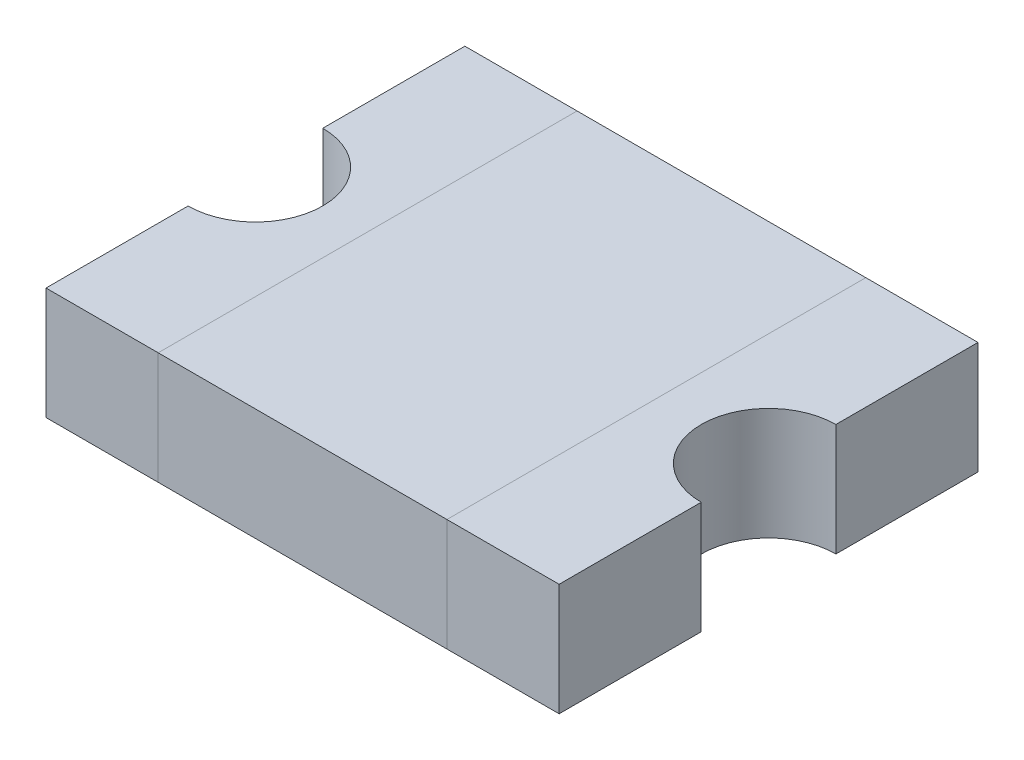
from build123d import *

# Parameters (mm, degrees)
SKETCH1_W             = 1.93
SKETCH1_H             = 2.8
BOSS_EXTRUDE1_DEPTH   = 0.75
BOSS_EXTRUDE3_DEPTH   = 0.75
BOSS_EXTRUDE3_2_DEPTH = 0.75


with BuildPart() as part:
    # Sketch1 → Boss-Extrude1 (new body)
    with BuildSketch(Plane(origin=(0, 0, 0), x_dir=(1, 0, 0), z_dir=(0, 1, 0))):
        Rectangle(SKETCH1_W, SKETCH1_H)
    extrude(amount=BOSS_EXTRUDE1_DEPTH)


with BuildPart() as body_2:
    # Sketch2 → Boss-Extrude3 (new body)
    with BuildSketch(Plane(origin=(0, 0, 0), x_dir=(1, 0, 0), z_dir=(0, 1, 0))):
        with BuildLine():
            Line((1.715, -0.45), (1.715, -1.4))
            Line((1.715, -1.4), (0.965, -1.4))
            Line((0.965, -1.4), (0.965, 1.4))
            Line((0.965, 1.4), (1.715, 1.4))
            Line((1.715, 1.4), (1.715, 0.45))
            ThreePointArc((1.715, 0.45), (1.265, 0), (1.715, -0.45))
        make_face()
    extrude(amount=BOSS_EXTRUDE3_DEPTH)


with BuildPart() as body_3:
    # Sketch2 → Boss-Extrude3 2 (new body)
    with BuildSketch(Plane(origin=(0, 0, 0), x_dir=(1, 0, 0), z_dir=(0, 1, 0))):
        with BuildLine():
            Line((-0.965, 1.4), (-0.965, -1.4))
            Line((-0.965, -1.4), (-1.715, -1.4))
            Line((-1.715, -1.4), (-1.715, -0.45))
            ThreePointArc((-1.715, -0.45), (-1.265, 0), (-1.715, 0.45))
            Line((-1.715, 0.45), (-1.715, 1.4))
            Line((-1.715, 1.4), (-0.965, 1.4))
        make_face()
    extrude(amount=BOSS_EXTRUDE3_2_DEPTH)


solid = Compound([part.part, body_2.part, body_3.part])
